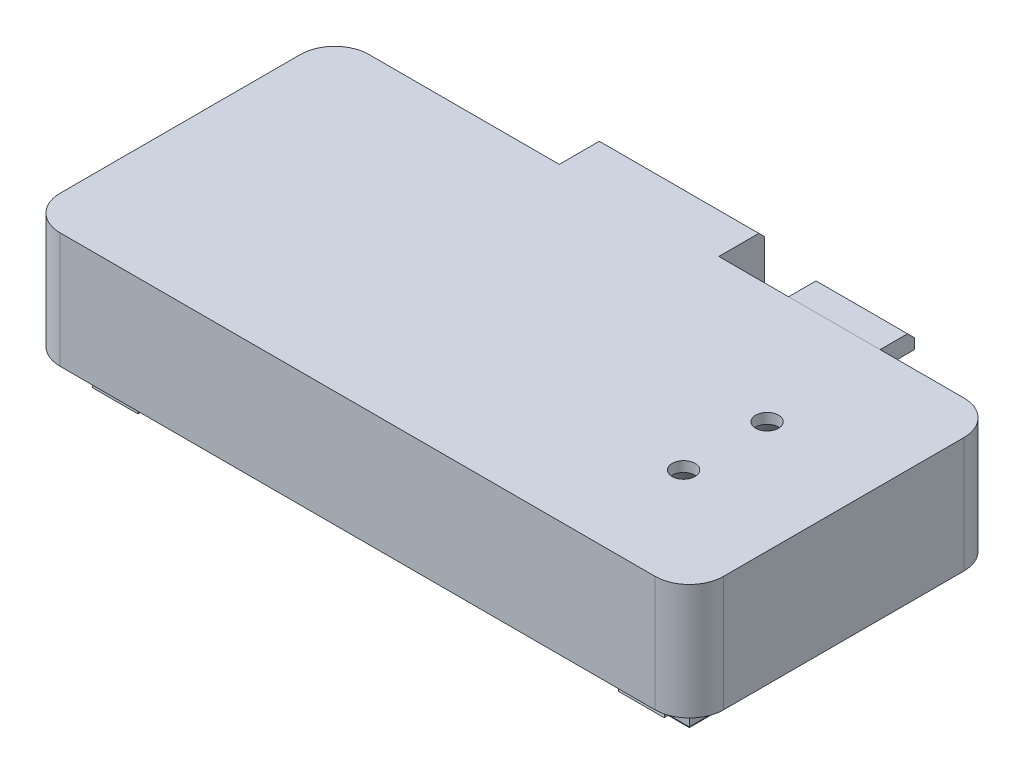
from build123d import *
from OCP.BRepFilletAPI import BRepFilletAPI_MakeChamfer

# Parameters (mm, degrees)
SKETCH2_W           = 54
SKETCH2_H           = 23
BOSS_EXTRUDE1_DEPTH = 8.107970875
BOSS_EXTRUDE2_DEPTH = 2
SKETCH4_W           = 6
SKETCH4_H           = 2
SKETCH4_W_2         = 6.878307032
BOSS_EXTRUDE3_DEPTH = 10.107970875
CUT_EXTRUDE1_REACH  = 48.568
SKETCH5_R           = 1
CHAMFER1_SIZE       = 0.8
CHAMFER1_SIZE2      = 1.101105536
BOSS_EXTRUDE4_DEPTH = 4
BOSS_EXTRUDE5_DEPTH = 4
CHAMFER2_SIZE       = 0.15
CHAMFER2_SIZE2      = 0.206457288
CHAMFER2_SIZE2_2    = 0.165098288
CHAMFER2_SIZE2_3    = 0.182384002
CUT_EXTRUDE3_REACH  = 597.348
SKETCH9_R           = 0.75
CUT_EXTRUDE4_DEPTH  = 1.2
CUT_EXTRUDE4_DRAFT  = -45
SKETCH11_W          = 0.693710498
SKETCH11_H          = 1
SKETCH11_W_2        = 1.506289502
SKETCH11_W_3        = 1.163270208
SKETCH11_W_4        = 1.036729792
SKETCH11_H_2        = 2
BOSS_EXTRUDE6_DEPTH = 2.5
SKETCH12_W          = 8
SKETCH12_H          = 1.5
BOSS_EXTRUDE7_DEPTH = 3
CHAMFER4_SIZE       = 0.6
SKETCH14_W          = 1.3
SKETCH14_H          = 1
SKETCH14_H_2        = 1.949699773
BOSS_EXTRUDE8_DEPTH = 4
SKETCH15_R          = 0.75
CUT_EXTRUDE5_DEPTH  = 2
SKETCH16_W          = 10.943315718
SKETCH16_H          = 7.507990824
CUT_EXTRUDE6_DEPTH  = 1
CUT_EXTRUDE6_DRAFT  = -45
SKETCH17_W          = 10.943315718
SKETCH17_H          = 0.816004588
BOSS_EXTRUDE9_DEPTH = 4
CHAMFER5_SIZE       = 0.5


with BuildPart() as part:
    # Sketch2 → Boss-Extrude1 (new body)
    with BuildSketch(Plane(origin=(0, -591.80280228, 0), x_dir=(1, 0, 0), z_dir=(0, 1, 0))):
        with BuildLine():
            ThreePointArc((-23.180504959, -25.453378229), (-22.301825302, -27.574698572), (-20.180504959, -28.453378229))
            Line((-20.180504959, -28.453378229), (31.819495041, -28.453378229))
            ThreePointArc((31.819495041, -28.453378229), (33.940815385, -27.574698572), (34.819495041, -25.453378229))
            Line((34.819495041, -25.453378229), (34.819495041, -4.453378229))
            ThreePointArc((34.819495041, -4.453378229), (33.940815385, -2.332057885), (31.819495041, -1.453378229))
            Line((31.819495041, -1.453378229), (-20.180504959, -1.453378229))
            ThreePointArc((-20.180504959, -1.453378229), (-22.301825302, -2.332057885), (-23.180504959, -4.453378229))
            Line((-23.180504959, -4.453378229), (-23.180504959, -25.453378229))
        make_face()
        with Locations((5.819495041, -14.953378229)):
            Rectangle(SKETCH2_W, SKETCH2_H, mode=Mode.SUBTRACT)
    extrude(amount=BOSS_EXTRUDE1_DEPTH)

    # Sketch3 → Boss-Extrude2 (add)
    with BuildSketch(Plane(origin=(0, -583.694831405, 0), x_dir=(1, 0, 0), z_dir=(0, 1, 0))):
        with BuildLine():
            Line((34.819495041, -25.453378229), (34.819495041, -4.453378229))
            ThreePointArc((34.819495041, -4.453378229), (33.940815385, -2.332057885), (31.819495041, -1.453378229))
            Line((31.819495041, -1.453378229), (-20.180504959, -1.453378229))
            ThreePointArc((-20.180504959, -1.453378229), (-22.301825302, -2.332057885), (-23.180504959, -4.453378229))
            Line((-23.180504959, -4.453378229), (-23.180504959, -25.453378229))
            ThreePointArc((-23.180504959, -25.453378229), (-22.301825302, -27.574698572), (-20.180504959, -28.453378229))
            Line((-20.180504959, -28.453378229), (31.819495041, -28.453378229))
            ThreePointArc((31.819495041, -28.453378229), (33.940815385, -27.574698572), (34.819495041, -25.453378229))
        make_face()
    extrude(amount=BOSS_EXTRUDE2_DEPTH)

    # Sketch4 → Boss-Extrude3 (add)
    with BuildSketch(Plane.XZ.offset(583.694831405)):
        with Locations((29.819495041, 25.453378229)):
            Rectangle(SKETCH4_W, SKETCH4_H)
        with Locations((29.819495041, 4.453378229)):
            Rectangle(SKETCH4_W, SKETCH4_H)
        with Locations((-18.180504959, 25.453378229)):
            Rectangle(SKETCH4_W, SKETCH4_H)
        with Locations((-18.180504959, 4.453378229)):
            Rectangle(SKETCH4_W, SKETCH4_H)
        with Locations((2.799436537, 25.453378229)):
            Rectangle(SKETCH4_W_2, SKETCH4_H)
    extrude(amount=BOSS_EXTRUDE3_DEPTH)

    # Sketch5 → Cut-Extrude1 (cut, up to next)
    with BuildSketch(Plane(origin=(0, -581.694831405, 0), x_dir=(1, 0, 0), z_dir=(0, 1, 0)), mode=Mode.PRIVATE) as cut_extrude1_sk1:
        with Locations(Location((25.019495041, -11.853378229, 0), (0, 0, 270))):
            Circle(SKETCH5_R)
    cut_extrude1_tool1 = extrude(cut_extrude1_sk1.sketch, amount=-CUT_EXTRUDE1_REACH, mode=Mode.PRIVATE) & part.part
    # Sketch5 → Cut-Extrude1 (cut, up to next)
    with BuildSketch(Plane(origin=(0, -581.694831405, 0), x_dir=(1, 0, 0), z_dir=(0, 1, 0)), mode=Mode.PRIVATE) as cut_extrude1_sk2:
        with Locations(Location((25.019495041, -19.153378229, 0), (0, 0, 270))):
            Circle(SKETCH5_R)
    cut_extrude1_tool2 = extrude(cut_extrude1_sk2.sketch, amount=-CUT_EXTRUDE1_REACH, mode=Mode.PRIVATE) & part.part
    add(cut_extrude1_tool1.solids().sort_by_distance((25.019495, -581.694831, 11.853378))[0], mode=Mode.SUBTRACT)
    add(cut_extrude1_tool2.solids().sort_by_distance((25.019495, -581.694831, 19.153378))[0], mode=Mode.SUBTRACT)

    # Chamfer1
    chamfer1_edges = [part.edges().sort_by_distance(p)[0] for p in [
        (25.019495041, -583.694831405, 10.853378229),
        (25.019495041, -583.694831405, 18.153378229),
    ]]
    chamfer1_side = [part.faces().sort_by_distance(p)[0] for p in [
        (5.75212361, -583.694831405, 14.827394231),
    ]]
    chamfer(chamfer1_edges, length=CHAMFER1_SIZE, length2=CHAMFER1_SIZE2, reference=chamfer1_side[0])

    # Sketch6 → Boss-Extrude4 (add)
    with BuildSketch(Plane.ZY.offset(-26.819495041)):
        Polygon((3.453378229, -592.80280228), (3.253378229, -593.80280228), (3.453378229, -593.80280228), align=None)
        Polygon((26.453378229, -593.80280228), (26.653378229, -593.80280228), (26.453378229, -592.80280228), align=None)
    extrude(amount=-BOSS_EXTRUDE4_DEPTH)

    # Sketch7 → Boss-Extrude5 (add)
    with BuildSketch(Plane(origin=(-15.180504959, 0, 0), x_dir=(0, 0, -1), z_dir=(1, 0, 0))):
        Polygon((-26.453378229, -593.80280228), (-26.653378229, -593.80280228), (-26.453378229, -591.80280228), align=None)
        Polygon((-3.453378229, -593.80280228), (-3.253378229, -593.80280228), (-3.453378229, -591.80280228), align=None)
    extrude(amount=-BOSS_EXTRUDE5_DEPTH)

    # Chamfer2: one chamfer whose edges measure the first distance from different faces: ONE call of the kernel's chamfer builder (chamfer() names one face for all edges)
    chamfer2_edges_1 = [part.edges().sort_by_distance(p)[0] for p in [
        (29.819495041, -593.80280228, 5.453378229),
        (31.819495041, -593.80280228, 3.453378229),
        (32.819495041, -593.80280228, 4.453378229),
        (26.819495041, -593.80280228, 4.453378229),
    ]]
    chamfer2_side_1 = [part.faces().sort_by_distance(p)[0] for p in [
        (29.756995041, -593.80280228, 4.384628229),
    ]]
    chamfer2_edges_2 = [part.edges().sort_by_distance(p)[0] for p in [
        (-20.180504959, -593.80280228, 26.453378229),
        (-21.180504959, -593.80280228, 25.453378229),
    ]]
    chamfer2_side_2 = [part.faces().sort_by_distance(p)[0] for p in [
        (-18.118004959, -593.80280228, 25.522128229),
    ]]
    chamfer2_edges_3 = [part.edges().sort_by_distance(p)[0] for p in [
        (-21.180504959, -593.80280228, 4.453378229),
        (-18.180504959, -593.80280228, 5.453378229),
        (-15.180504959, -593.80280228, 4.453378229),
        (-20.180504959, -593.80280228, 3.453378229),
    ]]
    chamfer2_side_3 = [part.faces().sort_by_distance(p)[0] for p in [
        (-18.118004959, -593.80280228, 4.384628229),
    ]]
    chamfer2_edges_4 = [part.edges().sort_by_distance(p)[0] for p in [
        (2.799436537, -593.80280228, 26.453378229),
    ]]
    chamfer2_side_4 = [part.faces().sort_by_distance(p)[0] for p in [
        (2.799436537, -593.80280228, 25.453378229),
    ]]
    chamfer2_edges_5 = [part.edges().sort_by_distance(p)[0] for p in [
        (28.819495041, -593.80280228, 3.253378229),
    ]]
    chamfer2_side_5 = [part.faces().sort_by_distance(p)[0] for p in [
        (29.756995041, -593.80280228, 4.384628229),
    ]]
    chamfer2_edges_6 = [part.edges().sort_by_distance(p)[0] for p in [
        (31.819495041, -593.80280228, 26.453378229),
        (32.819495041, -593.80280228, 25.453378229),
    ]]
    chamfer2_side_6 = [part.faces().sort_by_distance(p)[0] for p in [
        (29.756995041, -593.80280228, 25.522128229),
    ]]
    chamfer2_edges_7 = [part.edges().sort_by_distance(p)[0] for p in [
        (-17.180504959, -593.80280228, 3.253378229),
    ]]
    chamfer2_side_7 = [part.faces().sort_by_distance(p)[0] for p in [
        (-17.180504959, -592.80280228, 3.353378229),
    ]]
    chamfer2 = BRepFilletAPI_MakeChamfer(part.part.solid().wrapped)
    for e in chamfer2_edges_1:
        chamfer2.Add(CHAMFER2_SIZE, CHAMFER2_SIZE2, e.wrapped, chamfer2_side_1[0].wrapped)  # the first distance lies on this face
    for e in chamfer2_edges_2:
        chamfer2.Add(CHAMFER2_SIZE, CHAMFER2_SIZE2, e.wrapped, chamfer2_side_2[0].wrapped)  # the first distance lies on this face
    for e in chamfer2_edges_3:
        chamfer2.Add(CHAMFER2_SIZE, CHAMFER2_SIZE2, e.wrapped, chamfer2_side_3[0].wrapped)  # the first distance lies on this face
    for e in chamfer2_edges_4:
        chamfer2.Add(CHAMFER2_SIZE, CHAMFER2_SIZE2, e.wrapped, chamfer2_side_4[0].wrapped)  # the first distance lies on this face
    for e in chamfer2_edges_5:
        chamfer2.Add(CHAMFER2_SIZE, CHAMFER2_SIZE2_2, e.wrapped, chamfer2_side_5[0].wrapped)  # the first distance lies on this face
    for e in chamfer2_edges_6:
        chamfer2.Add(CHAMFER2_SIZE, CHAMFER2_SIZE2, e.wrapped, chamfer2_side_6[0].wrapped)  # the first distance lies on this face
    for e in chamfer2_edges_7:
        chamfer2.Add(CHAMFER2_SIZE, CHAMFER2_SIZE2_3, e.wrapped, chamfer2_side_7[0].wrapped)  # the first distance lies on this face
    add(Compound.cast(chamfer2.Shape()), mode=Mode.REPLACE)

    # Sketch9 → Cut-Extrude3 (cut, up to next)
    with BuildSketch(Plane.XY.offset(3.453378229), mode=Mode.PRIVATE) as cut_extrude3_sk1:
        with Locations((17.956804804, -584.994831405)):
            Circle(SKETCH9_R)
    cut_extrude3_tool1 = extrude(cut_extrude3_sk1.sketch, amount=-CUT_EXTRUDE3_REACH, mode=Mode.PRIVATE) & part.part
    # Sketch9 → Cut-Extrude3 (cut, up to next)
    with BuildSketch(Plane.XY.offset(3.453378229), mode=Mode.PRIVATE) as cut_extrude3_sk2:
        with Locations((20.496804804, -584.994831405)):
            Circle(SKETCH9_R)
    cut_extrude3_tool2 = extrude(cut_extrude3_sk2.sketch, amount=-CUT_EXTRUDE3_REACH, mode=Mode.PRIVATE) & part.part
    # Sketch9 → Cut-Extrude3 (cut, up to next)
    with BuildSketch(Plane.XY.offset(3.453378229), mode=Mode.PRIVATE) as cut_extrude3_sk3:
        with Locations((23.036804804, -584.994831405)):
            Circle(SKETCH9_R)
    cut_extrude3_tool3 = extrude(cut_extrude3_sk3.sketch, amount=-CUT_EXTRUDE3_REACH, mode=Mode.PRIVATE) & part.part
    add(cut_extrude3_tool1.solids().sort_by_distance((17.956805, -584.994831, 3.453378))[0], mode=Mode.SUBTRACT)
    add(cut_extrude3_tool2.solids().sort_by_distance((20.496805, -584.994831, 3.453378))[0], mode=Mode.SUBTRACT)
    add(cut_extrude3_tool3.solids().sort_by_distance((23.036805, -584.994831, 3.453378))[0], mode=Mode.SUBTRACT)


with BuildPart() as cut_extrude4_tool:
    # Sketch10 → Cut-Extrude4 (with draft: the straight prism first)
    with BuildSketch(Plane(origin=(0, 0, 1.453378229), x_dir=(-1, 0, 0), z_dir=(0, 0, -1))):
        with BuildLine():
            ThreePointArc((-16.996804804, -586.744831405), (-15.246804804, -584.994831405), (-16.996804804, -583.244831405))
            Line((-16.996804804, -583.244831405), (-23.996804804, -583.244831405))
            ThreePointArc((-23.996804804, -583.244831405), (-25.746804804, -584.994831405), (-23.996804804, -586.744831405))
            Line((-23.996804804, -586.744831405), (-16.996804804, -586.744831405))
        make_face()
    extrude(amount=-CUT_EXTRUDE4_DEPTH)
    # Cut-Extrude4: the draft: its side faces are tilted about the plane it starts from
    cut_extrude4_sides = [cut_extrude4_tool.faces().sort_by_distance(p)[0] for p in [
        (25.746804804, -584.994831405, 2.053378229),
        (20.496804804, -586.744831405, 2.053378229),
        (15.246804804, -584.994831405, 2.053378229),
        (20.496804804, -583.244831405, 2.053378229),
    ]]
    draft(cut_extrude4_sides, Plane(origin=(0, 0, 1.453378229), x_dir=(-1, 0, 0), z_dir=(0, 0, -1)), CUT_EXTRUDE4_DRAFT)


with BuildPart() as part_1:
    add(part.part)

    # Cut-Extrude4: cut by cut_extrude4_tool
    add(cut_extrude4_tool.part, mode=Mode.SUBTRACT)

    # Sketch11 → Boss-Extrude6 (add)
    with BuildSketch(Plane.XZ.offset(583.694831405)):
        with Locations((24.149949555, 3.953378229)):
            Rectangle(SKETCH11_W, SKETCH11_H)
        with Locations((21.849949555, 3.953378229)):
            Rectangle(SKETCH11_W_2, SKETCH11_H)
        with Locations((19.3151697, 3.953378229)):
            Rectangle(SKETCH11_W_3, SKETCH11_H)
        with Locations((17.0151697, 3.953378229)):
            Rectangle(SKETCH11_W_4, SKETCH11_H)
        with Locations((24.149949555, 7.993378229)):
            Rectangle(SKETCH11_W, SKETCH11_H_2)
        with Locations((21.849949555, 7.993378229)):
            Rectangle(SKETCH11_W_2, SKETCH11_H_2)
        with Locations((19.3151697, 7.993378229)):
            Rectangle(SKETCH11_W_3, SKETCH11_H_2)
        with Locations((17.0151697, 7.993378229)):
            Rectangle(SKETCH11_W_4, SKETCH11_H_2)
    extrude(amount=BOSS_EXTRUDE6_DEPTH)

    # Sketch14 → Boss-Extrude8 (add)
    with BuildSketch(Plane.XZ.offset(583.694831405)):
        with Locations((7.274547251, 3.953378229)):
            Rectangle(SKETCH14_W, SKETCH14_H)
        with Locations((4.574547251, 3.953378229)):
            Rectangle(SKETCH14_W, SKETCH14_H)
        with Locations((2.274547251, 3.953378229)):
            Rectangle(SKETCH14_W, SKETCH14_H)
        with Locations((-0.425452749, 3.953378229)):
            Rectangle(SKETCH14_W, SKETCH14_H)
        with Locations((-0.425452749, 7.968228116)):
            Rectangle(SKETCH14_W, SKETCH14_H_2)
        with Locations((2.274547251, 7.968228116)):
            Rectangle(SKETCH14_W, SKETCH14_H_2)
        with Locations((4.574547251, 7.968228116)):
            Rectangle(SKETCH14_W, SKETCH14_H_2)
        with Locations((7.274547251, 7.968228116)):
            Rectangle(SKETCH14_W, SKETCH14_H_2)
    extrude(amount=BOSS_EXTRUDE8_DEPTH)

    # Sketch15 → Cut-Extrude5 (cut)
    with BuildSketch(Plane.XY.offset(3.453378229)):
        with Locations((5.964547251, -584.994831405)):
            Circle(SKETCH15_R)
        with Locations((3.424547251, -584.994831405)):
            Circle(SKETCH15_R)
        with Locations((0.884547251, -584.994831405)):
            Circle(SKETCH15_R)
        with Locations((3.424547251, -587.534831405)):
            Circle(SKETCH15_R)
        with Locations((0.884547251, -587.534831405)):
            Circle(SKETCH15_R)
        with Locations((5.964547251, -587.534831405)):
            Circle(SKETCH15_R)
    extrude(amount=-CUT_EXTRUDE5_DEPTH, mode=Mode.SUBTRACT)


with BuildPart() as body_2:
    # Sketch12 → Boss-Extrude7 (new body)
    with BuildSketch(Plane(origin=(0, 0, 1.453378229), x_dir=(-1, 0, 0), z_dir=(0, 0, -1))):
        with Locations((-20.496804804, -582.444831405)):
            Rectangle(SKETCH12_W, SKETCH12_H)
    extrude(amount=BOSS_EXTRUDE7_DEPTH)

    # Chamfer4
    chamfer4_edges = [body_2.edges().sort_by_distance(p)[0] for p in [
        (20.496804804, -581.694831405, -1.546621771),
    ]]
    chamfer(chamfer4_edges, length=CHAMFER4_SIZE)


with BuildPart() as cut_extrude6_tool:
    # Sketch16 → Cut-Extrude6 (with draft: the straight prism first)
    with BuildSketch(Plane(origin=(0, 0, 1.453378229), x_dir=(-1, 0, 0), z_dir=(0, 0, -1))):
        with Locations((-3.424547251, -586.264831405)):
            Rectangle(SKETCH16_W, SKETCH16_H)
    extrude(amount=-CUT_EXTRUDE6_DEPTH)
    # Cut-Extrude6: the draft: its side faces are tilted about the plane it starts from
    cut_extrude6_sides = [cut_extrude6_tool.faces().sort_by_distance(p)[0] for p in [
        (8.89620511, -586.264831405, 1.953378229),
        (3.424547251, -590.018826817, 1.953378229),
        (-2.047110608, -586.264831405, 1.953378229),
        (3.424547251, -582.510835993, 1.953378229),
    ]]
    draft(cut_extrude6_sides, Plane(origin=(0, 0, 1.453378229), x_dir=(-1, 0, 0), z_dir=(0, 0, -1)), CUT_EXTRUDE6_DRAFT)


with BuildPart() as part_2:
    add(part_1.part)

    # Cut-Extrude6: cut by cut_extrude6_tool
    add(cut_extrude6_tool.part, mode=Mode.SUBTRACT)

    # Sketch17 → Boss-Extrude9 (add)
    with BuildSketch(Plane(origin=(0, 0, 1.453378229), x_dir=(-1, 0, 0), z_dir=(0, 0, -1))):
        with Locations((-3.424547251, -582.102833699)):
            Rectangle(SKETCH17_W, SKETCH17_H)
        Polygon((-8.89620511, -590.018826817), (-8.89620511, -582.510835993), (-8.89620511, -581.694831405), (-10.39620511, -581.694831405), (-10.39620511, -590.018826817), align=None)
        Polygon((2.047110608, -581.694831405), (2.047110608, -582.510835993), (2.047110608, -590.018826817), (3.547110608, -590.018826817), (3.547110608, -581.694831405), align=None)
    extrude(amount=BOSS_EXTRUDE9_DEPTH)

    # Chamfer5
    chamfer5_edges = [part_2.edges().sort_by_distance(p)[0] for p in [
        (3.424547251, -581.694831405, -2.546621771),
    ]]
    chamfer(chamfer5_edges, length=CHAMFER5_SIZE)


solid = Compound([body_2.part, part_2.part])
